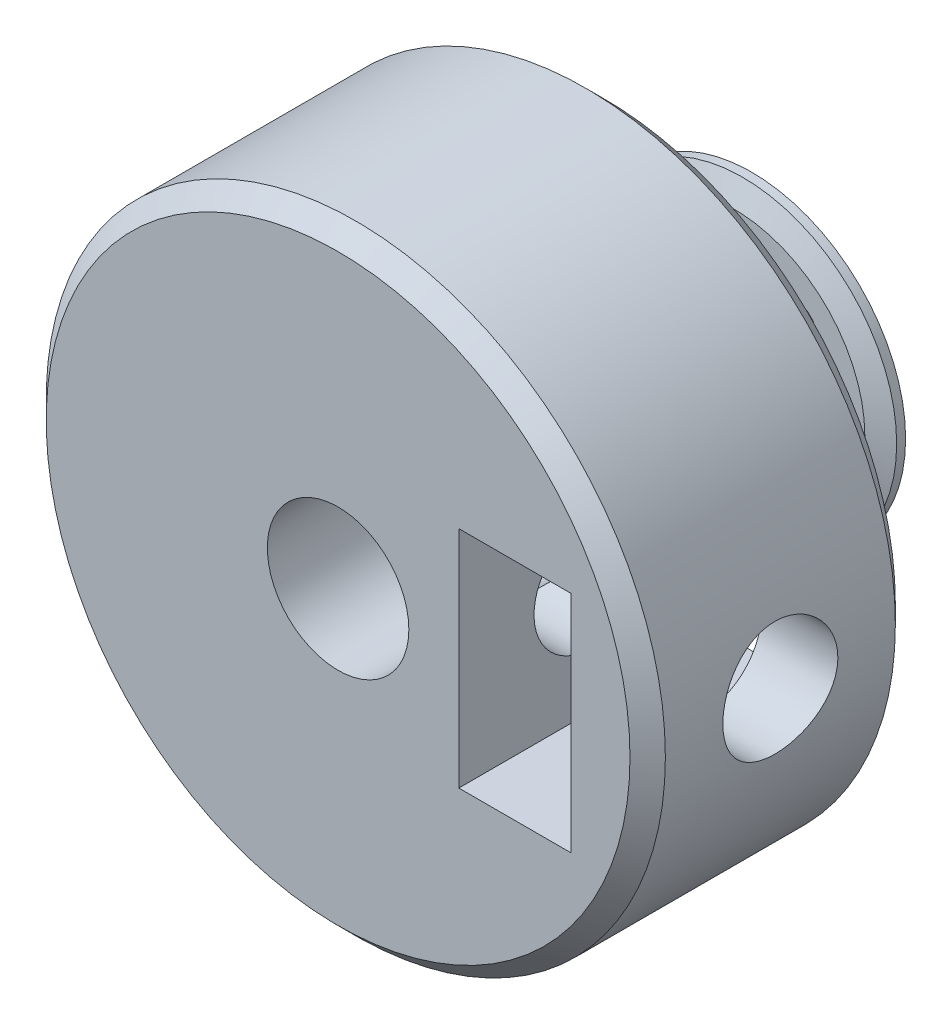
from build123d import *

# Parameters (mm, degrees)
CUT_EXTRUDE1_START             = -1.62
CUT_EXTRUDE1_DEPTH             = 7.37
CIRPATTERN1_COUNT              = 20
SKETCH4_R                      = 1.7526
CUT_EXTRUDE2_DEPTH             = 16.854418958
CUT_EXTRUDE3_DEPTH             = 1.31445
CIRPATTERN3_COUNT              = 2
CIRPATTERN3_ANGLE              = 90
CHAMFER1_SIZE                  = 0.28075
SKETCH7_R                      = 17.5
SKETCH7_R_2                    = 4
BOSS_EXTRUDE1_DEPTH            = 15
CHAMFER2_SIZE                  = 1
SKETCH8_W                      = 6.35
SKETCH8_H                      = 12.7
CUT_EXTRUDE4_DEPTH             = 29.939592309
CUT_EXTRUDE5_REACH             = 34.817
SKETCH9_R                      = 3.25
CUT_EXTRUDE5_DIRECTION_2_DEPTH = 33.817373869


with BuildPart() as part:
    # Sketch2 → Revolve1 (revolve)
    with BuildSketch(Plane(origin=(0, 0, 0), x_dir=(0, 0, -1), z_dir=(1, 0, 0)), mode=Mode.PRIVATE) as revolve1_sk:
        Polygon((-10, 4), (10, 4), (10, 8.6995), (9.495, 8.6995), (8.99, 7.404), (8.99, 6.1085), (1.62, 6.1085), (1.62, 7.404), (1.115, 8.6995), (-10, 8.6995), align=None)
    revolve(revolve1_sk.sketch.rotate(Axis((0, 0, 10), (0, 0, -1)), 90), axis=Axis((0, 0, 10), (0, 0, -1)))

    # Sketch3 → Cut-Extrude1 (cut)
    with BuildSketch(Plane.XY.offset(CUT_EXTRUDE1_START)):
        with BuildLine():
            Line((2.840989707, 8.6995), (-2.840989707, 8.6995))
            Line((-2.840989707, 8.6995), (-1.896292335, 5.806707124))
            ThreePointArc((-1.896292335, 5.806707124), (-1.330166224, 5.961914966), (-0.751756185, 6.062065233))
            ThreePointArc((-0.751756185, 6.062065233), (-0.643911332, 6.033664451), (-0.58547487, 5.93867868))
            ThreePointArc((-0.58547487, 5.93867868), (-0.551683777, 5.801420225), (-0.498876404, 5.670297753))
            ThreePointArc((-0.498876404, 5.670297753), (0, 5.3585), (0.498876404, 5.670297753))
            ThreePointArc((0.498876404, 5.670297753), (0.551683777, 5.801420225), (0.58547487, 5.93867868))
            ThreePointArc((0.58547487, 5.93867868), (0.643911332, 6.033664451), (0.751756185, 6.062065233))
            ThreePointArc((0.751756185, 6.062065233), (1.330166224, 5.961914966), (1.896292335, 5.806707124))
            Line((1.896292335, 5.806707124), (2.840989707, 8.6995))
        make_face()
    cut_extrude1 = extrude(amount=-CUT_EXTRUDE1_DEPTH, mode=Mode.SUBTRACT)

    # CirPattern1: Cut-Extrude1 ×20 about axis
    cirpattern1_axis = Axis((0, 0, 0), (0, 0, 1))
    for i in range(1, CIRPATTERN1_COUNT):
        add(cut_extrude1.rotate(cirpattern1_axis, i * 360 / CIRPATTERN1_COUNT), mode=Mode.SUBTRACT)

    # Sketch4 → Cut-Extrude2 (cut, through all)
    with BuildSketch(Plane(origin=(0, 0, 0), x_dir=(0, -1, 0), z_dir=(1, 0, 0))):
        with Locations(Location((0, -4.19, 0), (0, 0, 270))):
            Circle(SKETCH4_R)
    cut_extrude2 = extrude(amount=CUT_EXTRUDE2_DEPTH, mode=Mode.SUBTRACT)

    # Sketch5 → Revolve2 (revolve)
    with BuildSketch(Plane.XY.offset(4.19), mode=Mode.PRIVATE) as revolve2_sk:
        Polygon((4, -1.3716), (4, 0), (8.521132172, 0), (8.521132172, -1.3716), (8.140132172, -1.7526), (4.381, -1.7526), align=None)
    revolve2 = revolve(revolve2_sk.sketch.rotate(Axis((4, 0, 4.19), (1, 0, 0)), 270), axis=Axis((4, 0, 4.19), (1, 0, 0)))

    # Sketch6 → Cut-Extrude3 (cut)
    with BuildSketch(Plane(origin=(8.521132172, 5.384140679, 0), x_dir=(0, -1, 0), z_dir=(-1, 0, 0))):
        Polygon((5.384140679, 5.201864082), (4.507840679, 4.695932041), (4.507840679, 3.684067959), (5.384140679, 3.178135918), (6.260440679, 3.684067959), (6.260440679, 4.695932041), align=None)
    cut_extrude3 = extrude(amount=CUT_EXTRUDE3_DEPTH, mode=Mode.SUBTRACT)

    # CirPattern3: Cut-Extrude2, Revolve2, Cut-Extrude3 ×2 about axis
    cirpattern3_axis = Axis((0, 0, 0), (0, 0, 1))
    add([cut_extrude2.rotate(cirpattern3_axis, i * CIRPATTERN3_ANGLE / (CIRPATTERN3_COUNT - 1)) for i in range(1, CIRPATTERN3_COUNT)], mode=Mode.SUBTRACT)
    add([revolve2.rotate(cirpattern3_axis, i * CIRPATTERN3_ANGLE / (CIRPATTERN3_COUNT - 1)) for i in range(1, CIRPATTERN3_COUNT)])
    add([cut_extrude3.rotate(cirpattern3_axis, i * CIRPATTERN3_ANGLE / (CIRPATTERN3_COUNT - 1)) for i in range(1, CIRPATTERN3_COUNT)], mode=Mode.SUBTRACT)

    # Chamfer1
    chamfer1_edges = [part.edges().sort_by_distance(p)[0] for p in [
        (-4, 0, 10),
        (-8.6995, 0, 10),
    ]]
    chamfer(chamfer1_edges, length=CHAMFER1_SIZE)

    # Sketch7 → Boss-Extrude1 (add)
    with BuildSketch(Plane.XY.offset(-1.62)):
        Circle(SKETCH7_R)
        Circle(SKETCH7_R_2, mode=Mode.SUBTRACT)
    extrude(amount=BOSS_EXTRUDE1_DEPTH)

    # Chamfer2
    chamfer2_edges = [part.edges().sort_by_distance(p)[0] for p in [
        (-17.5, 0, 13.38),
        (-17.5, 0, -1.62),
    ]]
    chamfer(chamfer2_edges, length=CHAMFER2_SIZE)

    # Sketch8 → Cut-Extrude4 (cut, through all)
    with BuildSketch(Plane.XY.offset(-1.62)):
        with Locations((10, 0)):
            Rectangle(SKETCH8_W, SKETCH8_H)
    extrude(amount=CUT_EXTRUDE4_DEPTH, mode=Mode.SUBTRACT)

    # Sketch9 → Cut-Extrude5 (cut, up to next)
    with BuildSketch(Plane(origin=(6.825, 0, 0), x_dir=(0, 0, -1), z_dir=(1, 0, 0)), mode=Mode.PRIVATE) as cut_extrude5_sk1:
        with Locations(Location((-5.88, 0, 0), (0, 0, 270))):
            Circle(SKETCH9_R)
    cut_extrude5_tool1 = extrude(cut_extrude5_sk1.sketch, amount=-CUT_EXTRUDE5_REACH, mode=Mode.PRIVATE) & part.part
    add(cut_extrude5_tool1.solids().sort_by_distance((6.825, 0, 5.88))[0], mode=Mode.SUBTRACT)

    # Sketch9 → Cut-Extrude5 direction 2 (cut)
    with BuildSketch(Plane(origin=(6.825, 0, 0), x_dir=(0, 0, -1), z_dir=(1, 0, 0))):
        with Locations(Location((-5.88, 0, 0), (0, 0, 270))):
            Circle(SKETCH9_R)
    extrude(amount=CUT_EXTRUDE5_DIRECTION_2_DEPTH, mode=Mode.SUBTRACT)


solid = part.part
